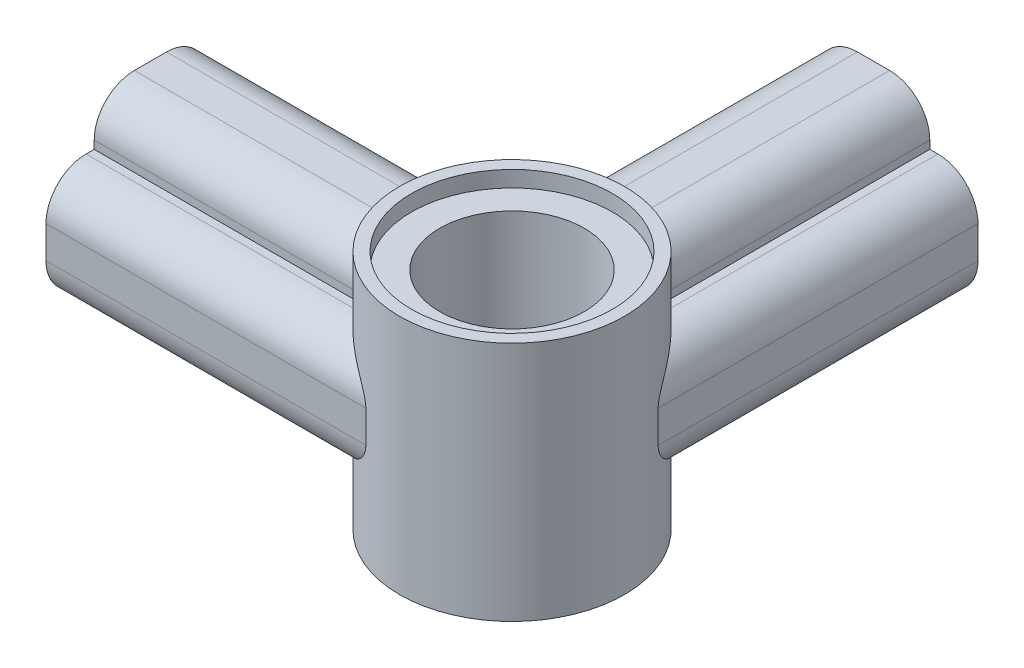
from build123d import *

# Parameters (mm, degrees)
EXTRUDE1_DEPTH     = 11.43
CIRPATTERN1_COUNT  = 2
CIRPATTERN1_ANGLE  = 90
SKETCH6_R          = 3.556
EXTRUDE2_DEPTH     = 3.81
SKETCH7_R          = 3.175
CUT_EXTRUDE2_DEPTH = 0.508
SKETCH8_R          = 2.286
CUT_EXTRUDE3_DEPTH = 21.144618306


with BuildPart() as part:
    # Sketch1 → Extrude1 (new body)
    with BuildSketch(Plane.XY):
        with BuildLine():
            Line((2.032, 1.778), (1.778, 1.778))
            Line((1.778, 1.778), (1.778, 2.032))
            ThreePointArc((1.778, 2.032), (1.406025612, 2.930025612), (0.508, 3.302))
            Line((0.508, 3.302), (-0.508, 3.302))
            ThreePointArc((-0.508, 3.302), (-1.406025612, 2.930025612), (-1.778, 2.032))
            Line((-1.778, 2.032), (-1.778, 1.778))
            Line((-1.778, 1.778), (-2.032, 1.778))
            ThreePointArc((-2.032, 1.778), (-2.930025612, 1.406025612), (-3.302, 0.508))
            Line((-3.302, 0.508), (-3.302, -0.508))
            ThreePointArc((-3.302, -0.508), (-2.930025612, -1.406025612), (-2.032, -1.778))
            Line((-2.032, -1.778), (-1.778, -1.778))
            Line((-1.778, -1.778), (-1.778, -2.032))
            ThreePointArc((-1.778, -2.032), (-1.406025612, -2.930025612), (-0.508, -3.302))
            Line((-0.508, -3.302), (0.508, -3.302))
            ThreePointArc((0.508, -3.302), (1.406025612, -2.930025612), (1.778, -2.032))
            Line((1.778, -2.032), (1.778, -1.778))
            Line((1.778, -1.778), (2.032, -1.778))
            ThreePointArc((2.032, -1.778), (2.930025612, -1.406025612), (3.302, -0.508))
            Line((3.302, -0.508), (3.302, 0.508))
            ThreePointArc((3.302, 0.508), (2.930025612, 1.406025612), (2.032, 1.778))
        make_face()
        with BuildLine():
            Line((-0.762, 2.032), (-0.762, 1.016))
            ThreePointArc((-0.762, 1.016), (-0.836394878, 0.836394878), (-1.016, 0.762))
            Line((-1.016, 0.762), (-2.032, 0.762))
            ThreePointArc((-2.032, 0.762), (-2.211605122, 0.687605122), (-2.286, 0.508))
            Line((-2.286, 0.508), (-2.286, -0.508))
            ThreePointArc((-2.286, -0.508), (-2.211605122, -0.687605122), (-2.032, -0.762))
            Line((-2.032, -0.762), (-1.016, -0.762))
            ThreePointArc((-1.016, -0.762), (-0.836394878, -0.836394878), (-0.762, -1.016))
            Line((-0.762, -1.016), (-0.762, -2.032))
            ThreePointArc((-0.762, -2.032), (-0.687605122, -2.211605122), (-0.508, -2.286))
            Line((-0.508, -2.286), (0.508, -2.286))
            ThreePointArc((0.508, -2.286), (0.687605122, -2.211605122), (0.762, -2.032))
            Line((0.762, -2.032), (0.762, -1.016))
            ThreePointArc((0.762, -1.016), (0.836394878, -0.836394878), (1.016, -0.762))
            Line((1.016, -0.762), (2.032, -0.762))
            ThreePointArc((2.032, -0.762), (2.211605122, -0.687605122), (2.286, -0.508))
            Line((2.286, -0.508), (2.286, 0.508))
            ThreePointArc((2.286, 0.508), (2.211605122, 0.687605122), (2.032, 0.762))
            Line((2.032, 0.762), (1.016, 0.762))
            ThreePointArc((1.016, 0.762), (0.836394878, 0.836394878), (0.762, 1.016))
            Line((0.762, 1.016), (0.762, 2.032))
            ThreePointArc((0.762, 2.032), (0.687605122, 2.211605122), (0.508, 2.286))
            Line((0.508, 2.286), (-0.508, 2.286))
            ThreePointArc((-0.508, 2.286), (-0.687605122, 2.211605122), (-0.762, 2.032))
        make_face(mode=Mode.SUBTRACT)
    extrude1 = extrude(amount=EXTRUDE1_DEPTH)

    # CirPattern1: Extrude1 ×2 about axis
    cirpattern1_axis = Axis((0, 0, 11.43), (0, 1, 0))
    for i in range(1, CIRPATTERN1_COUNT):
        add(extrude1.rotate(cirpattern1_axis, i * CIRPATTERN1_ANGLE / (CIRPATTERN1_COUNT - 1)))

    # Sketch6 → Extrude2 (add, symmetric)
    with BuildSketch(Plane(origin=(0, 0, 0), x_dir=(1, 0, 0), z_dir=(0, 1, 0))):
        with Locations(Location((0, -11.43, 0), (0, 0, 270))):
            Circle(SKETCH6_R)
    extrude(amount=EXTRUDE2_DEPTH, both=True)

    # Sketch7 → Cut-Extrude2 (cut)
    with BuildSketch(Plane(origin=(0, 3.81, 0), x_dir=(1, 0, 0), z_dir=(0, 1, 0))):
        with Locations(Location((0, -11.43, 0), (0, 0, 270))):
            Circle(SKETCH7_R)
    cut_extrude2 = extrude(amount=-CUT_EXTRUDE2_DEPTH, mode=Mode.SUBTRACT)

    # Mirror1: Cut-Extrude2 across plane
    add(cut_extrude2.mirror(Plane.ZX), mode=Mode.SUBTRACT)

    # Sketch8 → Cut-Extrude3 (cut, through all)
    with BuildSketch(Plane(origin=(0, 3.302, 0), x_dir=(1, 0, 0), z_dir=(0, 1, 0))):
        with Locations(Location((0, -11.43, 0), (0, 0, 270))):
            Circle(SKETCH8_R)
    extrude(amount=-CUT_EXTRUDE3_DEPTH, mode=Mode.SUBTRACT)


solid = part.part
